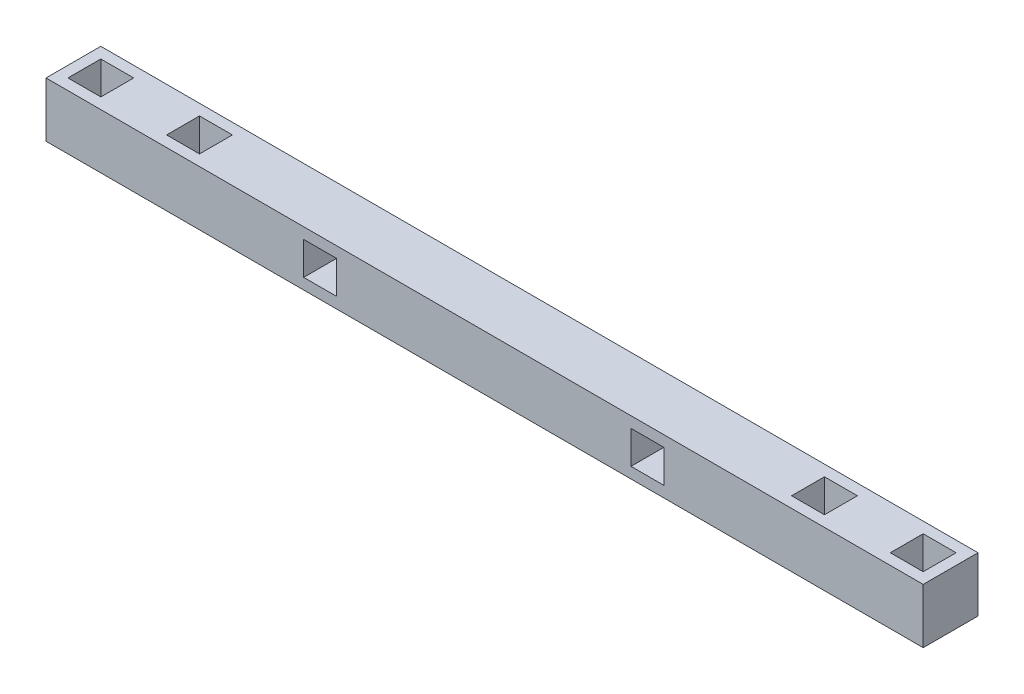
from build123d import *

# Parameters (mm, degrees)
SKETCH1_W           = 80
SKETCH1_H           = 5
SKETCH1_W_2         = 3
SKETCH1_H_2         = 3
BOSS_EXTRUDE1_DEPTH = 5
SKETCH2_W           = 3
SKETCH2_H           = 3
CUT_EXTRUDE1_DEPTH  = 5


with BuildPart() as part:
    # Sketch1 → Boss-Extrude1 (new body)
    with BuildSketch(Plane.XY):
        with Locations((40, 2.5)):
            Rectangle(SKETCH1_W, SKETCH1_H)
        with Locations((54.85, 2.5)):
            Rectangle(SKETCH1_W_2, SKETCH1_H_2, mode=Mode.SUBTRACT)
        with Locations((25, 2.5)):
            Rectangle(SKETCH1_W_2, SKETCH1_H_2, mode=Mode.SUBTRACT)
    extrude(amount=BOSS_EXTRUDE1_DEPTH)

    # Sketch2 → Cut-Extrude1 (cut)
    with BuildSketch(Plane(origin=(0, 5, 0), x_dir=(1, 0, 0), z_dir=(0, 1, 0))):
        with Locations((77.5, -2.5)):
            Rectangle(SKETCH2_W, SKETCH2_H)
        with Locations((2.5, -2.5)):
            Rectangle(SKETCH2_W, SKETCH2_H)
        with Locations((11.5, -2.5)):
            Rectangle(SKETCH2_W, SKETCH2_H)
        with Locations((68.5, -2.5)):
            Rectangle(SKETCH2_W, SKETCH2_H)
    extrude(amount=-CUT_EXTRUDE1_DEPTH, mode=Mode.SUBTRACT)


solid = part.part
